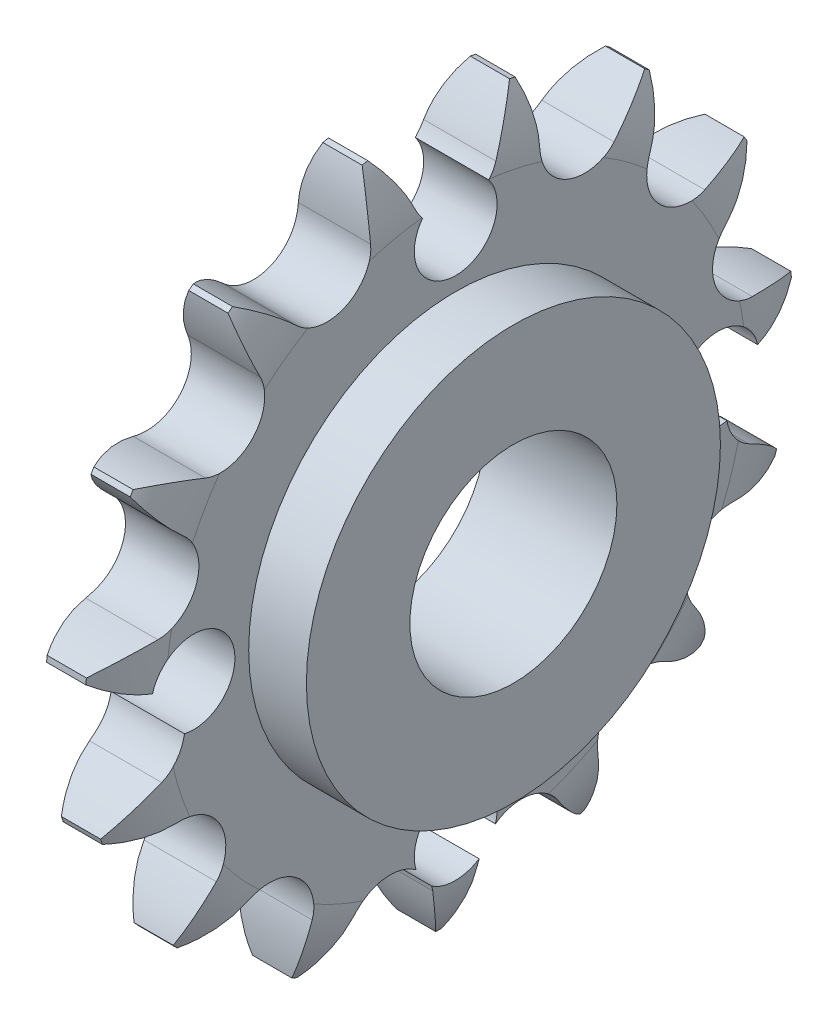
from build123d import *

# Parameters (mm, degrees)
TOOTHCUT_DEPTH      = 37.710811315
TEETHCUTS_COUNT     = 15
TEETHCUTS_ANGLE     = 336
BORSKE_R            = 5
BORE_DEPTH          = 50.0005
SKETCH1_R           = 15
SKETCH1_R_2         = 7.5
BOSS_EXTRUDE1_DEPTH = 24.6804
CUT_EXTRUDE2_START  = -18.5
SKETCH3_R           = 7.5
CUT_EXTRUDE2_DEPTH  = 18.5
SKETCH2_R           = 17.797607849
CUT_EXTRUDE1_DEPTH  = 20.5
SKETCH4_R           = 3
CUT_EXTRUDE4_DEPTH  = 18.5


with BuildPart() as part:
    # BasProSke → Base-Revolve (revolve)
    with BuildSketch(Plane(origin=(0, 0, 0), x_dir=(1, 0, 0), z_dir=(0, 1, 0)), mode=Mode.PRIVATE) as base_revolve_sk:
        with BuildLine():
            Line((0, 0), (0, 20.988608354))
            ThreePointArc((0, 20.988608354), (0.314698702, 23.416771239), (1.238, 25.684484843))
            Line((1.238, 25.684484843), (4.0816, 25.684484843))
            ThreePointArc((4.0816, 25.684484843), (5.004901298, 23.416771239), (5.3196, 20.988608354))
            Line((5.3196, 20.988608354), (5.3196, 0))
            Line((5.3196, 0), (0, 0))
        make_face()
    revolve(base_revolve_sk.sketch.rotate(Axis((-10, 0, 0), (1, 0, 0)), 180), axis=Axis((-10, 0, 0), (1, 0, 0)))

    # TooCutSke → ToothCut (cut, through all)
    with BuildSketch(Plane(origin=(0, 0, 0), x_dir=(0, 0, -1), z_dir=(1, 0, 0))):
        with BuildLine():
            ThreePointArc((2.951828939, 21.685132796), (4.063020217, 23.756940993), (5.530366998, 25.593793922))
            ThreePointArc((5.530366998, 25.593793922), (0, 26.184484843), (-5.530366998, 25.593793922))
            ThreePointArc((-5.530366998, 25.593793922), (-4.063020217, 23.756940993), (-2.951828939, 21.685132796))
            ThreePointArc((-2.951828939, 21.685132796), (0, 19.731359843), (2.951828939, 21.685132796))
        make_face()
    toothcut = extrude(amount=TOOTHCUT_DEPTH, mode=Mode.SUBTRACT)

    # TeethCuts: ToothCut ×15 about axis
    teethcuts_axis = Axis((-10, 0, 0), (1, 0, 0))
    for i in range(1, TEETHCUTS_COUNT):
        add(toothcut.rotate(teethcuts_axis, i * TEETHCUTS_ANGLE / (TEETHCUTS_COUNT - 1)), mode=Mode.SUBTRACT)

    # BorSke → Bore (cut, symmetric)
    with BuildSketch(Plane(origin=(0, 0, 0), x_dir=(0, 0, -1), z_dir=(1, 0, 0))):
        with Locations(Location((0, 0, 0), (0, 0, 180))):
            Circle(BORSKE_R)
    extrude(amount=BORE_DEPTH, both=True, mode=Mode.SUBTRACT)

    # Sketch1 → Boss-Extrude1 (add)
    with BuildSketch(Plane(origin=(5.3196, 0, 0), x_dir=(0, 0, -1), z_dir=(1, 0, 0))):
        with Locations(Location((0, 0, 0), (0, 0, 180))):
            Circle(SKETCH1_R)
        Circle(SKETCH1_R_2, mode=Mode.SUBTRACT)
    extrude(amount=BOSS_EXTRUDE1_DEPTH)

    # Sketch3 → Cut-Extrude2 (cut)
    with BuildSketch(Plane(origin=(5.3196, 0, 0), x_dir=(0, 0, -1), z_dir=(1, 0, 0)).offset(CUT_EXTRUDE2_START)):
        Circle(SKETCH3_R)
    extrude(amount=CUT_EXTRUDE2_DEPTH, mode=Mode.SUBTRACT)

    # Sketch2 → Cut-Extrude1 (cut)
    with BuildSketch(Plane(origin=(30, 0, 0), x_dir=(0, 0, -1), z_dir=(1, 0, 0))):
        Circle(SKETCH2_R)
    extrude(amount=-CUT_EXTRUDE1_DEPTH, mode=Mode.SUBTRACT)

    # Sketch4 → Cut-Extrude4 (cut)
    with BuildSketch(Plane(origin=(9.5, 0, 0), x_dir=(0, 0, -1), z_dir=(1, 0, 0))):
        with Locations((0, 19)):
            Circle(SKETCH4_R)
        with Locations((19, 0)):
            Circle(SKETCH4_R)
        with Locations((0, -19)):
            Circle(SKETCH4_R)
        with Locations((-19, 0)):
            Circle(SKETCH4_R)
    extrude(amount=-CUT_EXTRUDE4_DEPTH, mode=Mode.SUBTRACT)


with BuildPart() as cut_extrude4_piece_1:
    # of the separate pieces the step leaves, piece 1, a body of its own (cut_extrude4_pieces)
    add(part.part.solids().sort_by_distance((0, -19.847140315, 2.877907797))[0])


with BuildPart() as cut_extrude4_piece_2:
    # of the separate pieces the step leaves, piece 2, a body of its own (cut_extrude4_pieces)
    add(part.part.solids().sort_by_distance((5.304176995, -21.462089431, 1.714093239))[0])


solid = Compound([cut_extrude4_piece_1.part, cut_extrude4_piece_2.part])
